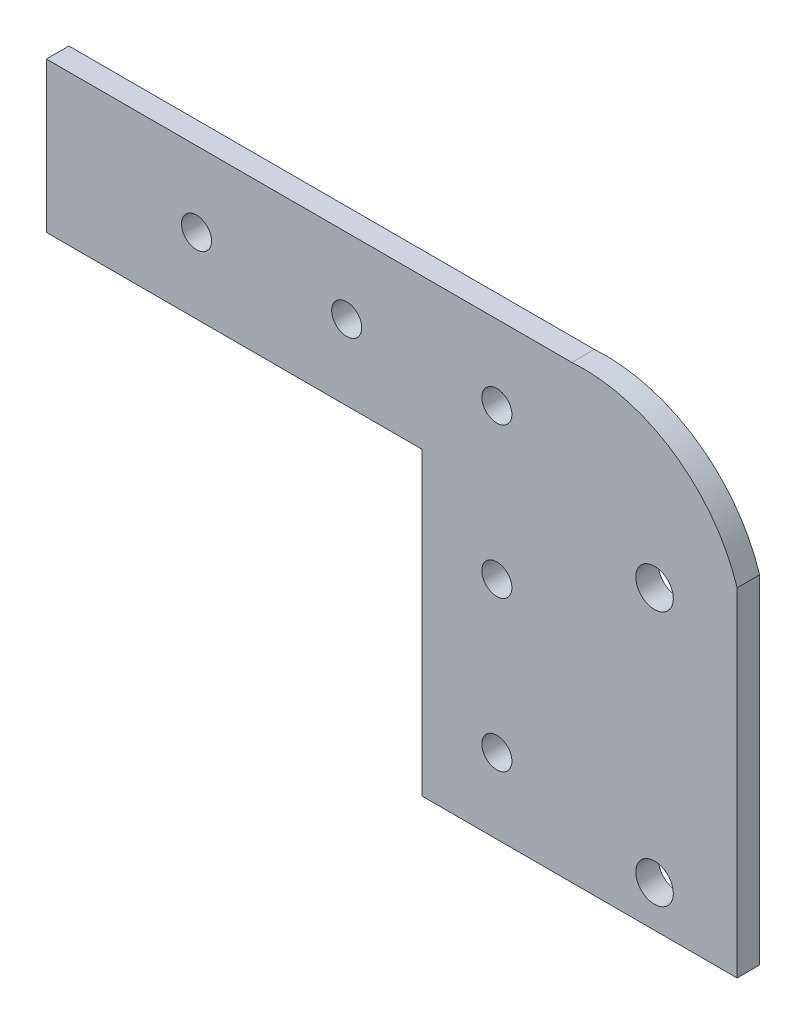
from build123d import *

# Parameters (mm, degrees)
SKETCH_1_W          = 20
SKETCH_1_H          = 40
SKETCH_1_W_2        = 50
SKETCH_1_H_2        = 20
EXTRUDE_1_DEPTH     = 3
SKETCH_2_R          = 2
CUT_EXTRUDE_1_DEPTH = 10
EXTRUDE_2_DEPTH     = 3


with BuildPart() as part:
    # 草图1 → 凸台-拉伸1 (new body)
    with BuildSketch(Plane.XY):
        with Locations((-20, -50)):
            Rectangle(SKETCH_1_W, SKETCH_1_H)
        with BuildLine():
            Line((-10, -30), (-10, -70))
            Line((-10, -70), (1, -70))
            Line((1, -70), (1, -67))
            ThreePointArc((1, -67), (-1.5, -64.5), (1, -62))
            Line((1, -62), (1, -33))
            ThreePointArc((1, -33), (-0.947653554, -32.067369017), (-1.442153468, -29.965316507))
            ThreePointArc((-1.442153468, -29.965316507), (-5.782490578, -29.437438793), (-10, -28.284271247))
            Line((-10, -28.284271247), (-10, -30))
        make_face()
        with BuildLine():
            Line((1, -67), (1, -70))
            Line((1, -70), (12, -70))
            Line((12, -70), (12, -27.49545417))
            ThreePointArc((12, -27.49545417), (7.787152469, -28.971714765), (3.401885012, -29.806495573))
            ThreePointArc((3.401885012, -29.806495573), (3.475349726, -30.149794724), (3.5, -30.5))
            ThreePointArc((3.5, -30.5), (2.767766953, -32.267766953), (1, -33))
            Line((1, -33), (1, -62))
            ThreePointArc((1, -62), (2.767766953, -62.732233047), (3.5, -64.5))
            ThreePointArc((3.5, -64.5), (2.767766953, -66.267766953), (1, -67))
        make_face()
        with BuildLine():
            Line((-10, -25), (-10, -28.284271247))
            ThreePointArc((-10, -28.284271247), (-5.782490578, -29.437438793), (-1.442153468, -29.965316507))
            ThreePointArc((-1.442153468, -29.965316507), (-0.567369017, -28.552346446), (1, -28))
            Line((1, -28), (1, -25))
            Line((1, -25), (-10, -25))
        make_face()
        with BuildLine():
            ThreePointArc((3.401885012, -29.806495573), (7.787152469, -28.971714765), (12, -27.49545417))
            Line((12, -27.49545417), (12, -25))
            Line((12, -25), (1, -25))
            Line((1, -25), (1, -28))
            ThreePointArc((1, -28), (2.502704052, -28.502030898), (3.401885012, -29.806495573))
        make_face()
        with BuildLine():
            Line((-30, -10), (-30, -30))
            Line((-30, -30), (-10, -30))
            Line((-10, -30), (-10, -28.284271247))
            ThreePointArc((-10, -28.284271247), (-21.213203436, -21.213203436), (-28.284271247, -10))
            Line((-28.284271247, -10), (-30, -10))
        make_face()
        with BuildLine():
            ThreePointArc((-28.284271247, -10), (-21.213203436, -21.213203436), (-10, -28.284271247))
            Line((-10, -28.284271247), (-10, -25))
            Line((-10, -25), (-10, -10))
            Line((-10, -10), (-28.284271247, -10))
        make_face()
        with Locations((-55, -20)):
            Rectangle(SKETCH_1_W_2, SKETCH_1_H_2)
    extrude(amount=EXTRUDE_1_DEPTH)

    # 草图2 → 切除-拉伸1 (cut)
    with BuildSketch(Plane(origin=(0, 0, 0), x_dir=(-1, 0, 0), z_dir=(0, 0, -1))):
        with Locations((20, -40)):
            Circle(SKETCH_2_R)
        with Locations((40, -20)):
            Circle(SKETCH_2_R)
        with Locations((20, -20)):
            Circle(SKETCH_2_R)
        with Locations((20, -60)):
            Circle(SKETCH_2_R)
        with Locations((60, -20)):
            Circle(SKETCH_2_R)
    extrude(amount=-CUT_EXTRUDE_1_DEPTH, mode=Mode.SUBTRACT)

    # 草图3 → 凸台-拉伸2 (add)
    with BuildSketch(Plane.XY.offset(3)):
        with BuildLine():
            Line((-10, -25), (12, -25))
            ThreePointArc((12, -25), (3.597916023, -13.689723166), (-10, -10))
            Line((-10, -10), (-10, -25))
        make_face()
    extrude(amount=-EXTRUDE_2_DEPTH)


solid = part.part
